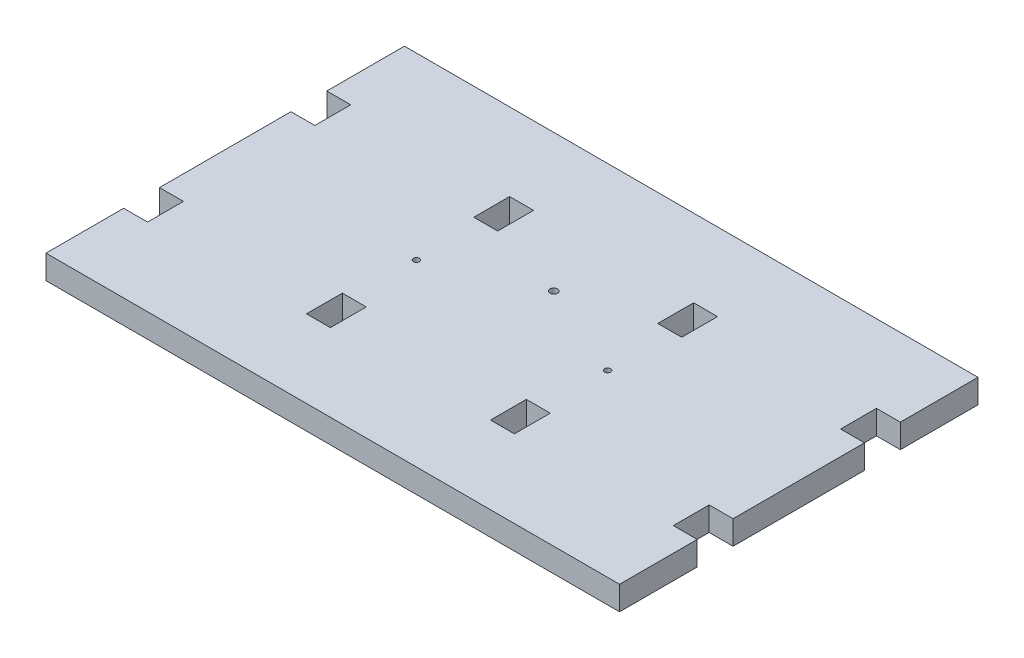
from build123d import *

# Parameters (mm, degrees)
SKETCH1_W          = 304.8
SKETCH1_H          = 190.5
EXTRUDE1_DEPTH     = 12.7
SKETCH2_W          = 12.7
SKETCH2_H          = 19.05
EXTRUDE2_DEPTH     = 181.165514181
SKETCH3_R          = 1.5875
CUT_EXTRUDE1_DEPTH = 181.165514181
SKETCH4_R          = 2.032
CUT_EXTRUDE2_DEPTH = 181.165514181


with BuildPart() as part:
    # Sketch1 → Extrude1 (new body)
    with BuildSketch(Plane(origin=(0, 0, 0), x_dir=(1, 0, 0), z_dir=(0, 1, 0))):
        Rectangle(SKETCH1_W, SKETCH1_H)
    extrude(amount=EXTRUDE1_DEPTH)

    # Sketch2 → Extrude2 (cut, through all)
    with BuildSketch(Plane(origin=(0, 12.7, 0), x_dir=(1, 0, 0), z_dir=(0, 1, 0))):
        with Locations((-48.895, 44.45)):
            Rectangle(SKETCH2_W, SKETCH2_H)
        with Locations((48.895, 44.45)):
            Rectangle(SKETCH2_W, SKETCH2_H)
        with Locations((-48.895, -44.45)):
            Rectangle(SKETCH2_W, SKETCH2_H)
        with Locations((48.895, -44.45)):
            Rectangle(SKETCH2_W, SKETCH2_H)
        with Locations((146.05, 44.45)):
            Rectangle(SKETCH2_W, SKETCH2_H)
        with Locations((-146.05, 44.45)):
            Rectangle(SKETCH2_W, SKETCH2_H)
        with Locations((146.05, -44.45)):
            Rectangle(SKETCH2_W, SKETCH2_H)
        with Locations((-146.05, -44.45)):
            Rectangle(SKETCH2_W, SKETCH2_H)
    extrude(amount=-EXTRUDE2_DEPTH, mode=Mode.SUBTRACT)

    # Sketch3 → Cut-Extrude1 (cut, through all)
    with BuildSketch(Plane.XZ):
        with Locations(Location((50.8, 0, 0), (0, 0, 270))):
            Circle(SKETCH3_R)
        with Locations(Location((-50.8, 0, 0), (0, 0, 270))):
            Circle(SKETCH3_R)
    extrude(amount=-CUT_EXTRUDE1_DEPTH, mode=Mode.SUBTRACT)

    # Sketch4 → Cut-Extrude2 (cut, through all)
    with BuildSketch(Plane(origin=(0, 12.7, 0), x_dir=(1, 0, 0), z_dir=(0, 1, 0))):
        with Locations(Location((0, 22.225, 0), (0, 0, 270))):
            Circle(SKETCH4_R)
    extrude(amount=-CUT_EXTRUDE2_DEPTH, mode=Mode.SUBTRACT)


solid = part.part
